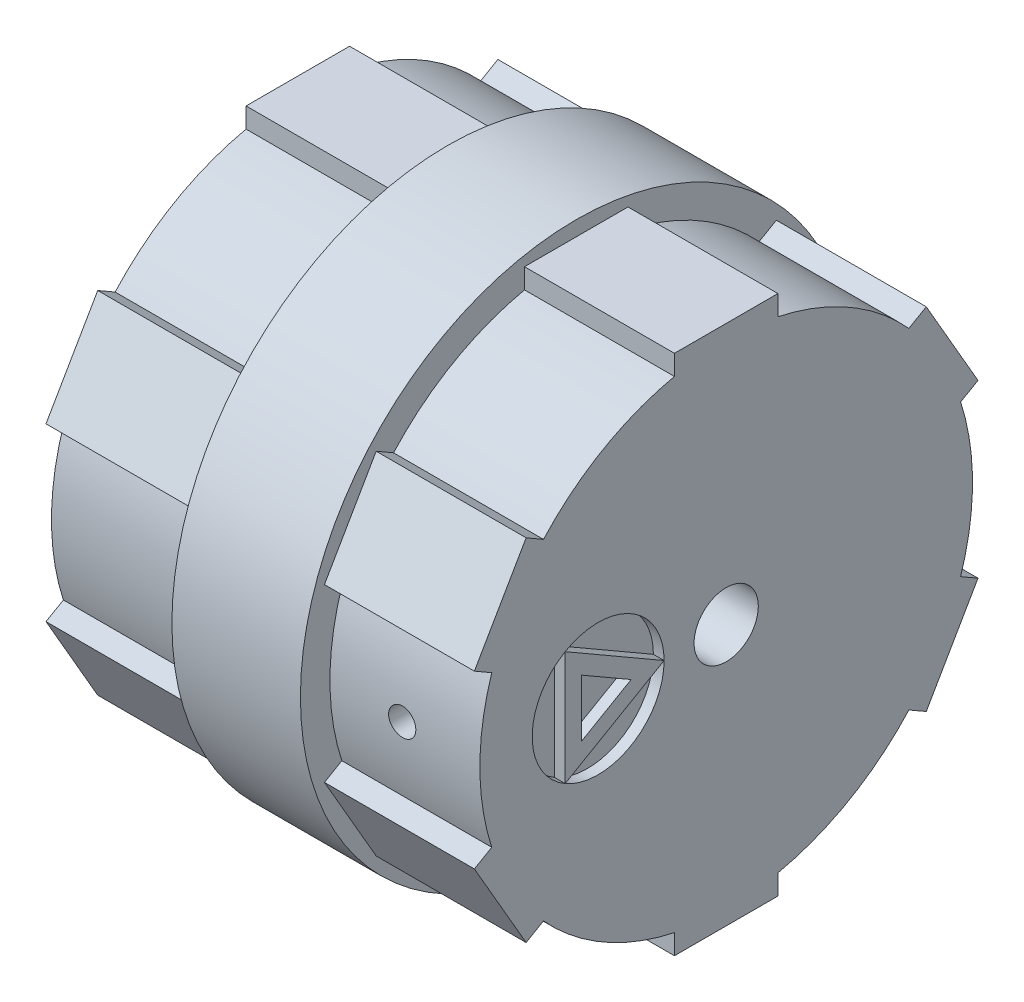
from build123d import *

# Parameters (mm, degrees)
CROQUIS1_R              = 11.5
SALIENTE_EXTRUIR1_DEPTH = 20
VACIADO2_T              = -3
CROQUIS2_R              = 1.5
CORTAR_EXTRUIR1_DEPTH   = 20
CROQUIS3_W              = 4.830825058
CROQUIS3_H              = 1.361160648
SALIENTE_EXTRUIR2_DEPTH = 20
CROQUIS4_W              = 6
CROQUIS4_H              = 1.635071494
CROQUIS5_R              = 4
CROQUIS5_R_2            = 1.5
SALIENTE_EXTRUIR3_DEPTH = 4
CROQUIS6_R              = 3.079540119
CORTAR_EXTRUIR3_DEPTH   = 0.5
SALIENTE_EXTRUIR4_DEPTH = 0.5
CROQUIS9_R              = 0.635
CORTAR_EXTRUIR4_DEPTH   = 20


with BuildPart() as part:
    # Croquis1 → Saliente-Extruir1 (new body)
    with BuildSketch(Plane(origin=(0, 0, 0), x_dir=(0, 0, -1), z_dir=(1, 0, 0))):
        Circle(CROQUIS1_R)
    extrude(amount=SALIENTE_EXTRUIR1_DEPTH)

    # Vaciado2
    vaciado2_openings = [part.faces().sort_by_distance(p)[0] for p in [
        (0, 0, 0),
    ]]
    offset(amount=VACIADO2_T, openings=vaciado2_openings, kind=Kind.INTERSECTION)

    # Croquis2 → Cortar-Extruir1 (cut)
    with BuildSketch(Plane(origin=(20, 0, 0), x_dir=(0, 0, -1), z_dir=(1, 0, 0))):
        Circle(CROQUIS2_R)
    extrude(amount=-CORTAR_EXTRUIR1_DEPTH, mode=Mode.SUBTRACT)

    # Croquis3 → Saliente-Extruir2 (add, through all)
    with BuildSketch(Plane(origin=(20, 0, 0), x_dir=(0, 0, -1), z_dir=(1, 0, 0))):
        with Locations((0, 11.5)):
            Rectangle(CROQUIS3_W, CROQUIS3_H)
        Polygon((8.162186029, 7.501518448), (9.340985729, 8.182098773), (11.756398258, 3.998481552), (10.577598558, 3.317901227), align=None)
        Polygon((10.577598558, -3.317901227), (11.756398258, -3.998481552), (9.340985729, -8.182098773), (8.162186029, -7.501518448), align=None)
        with Locations((0, -11.5)):
            Rectangle(CROQUIS3_W, CROQUIS3_H)
        Polygon((-8.162186029, -7.501518448), (-9.340985729, -8.182098773), (-11.756398258, -3.998481552), (-10.577598558, -3.317901227), align=None)
        Polygon((-10.577598558, 3.317901227), (-11.756398258, 3.998481552), (-9.340985729, 8.182098773), (-8.162186029, 7.501518448), align=None)
    extrude(amount=-SALIENTE_EXTRUIR2_DEPTH)

    # Croquis4 → Revolución1 (revolve)
    with BuildSketch(Plane.XY, mode=Mode.PRIVATE) as revoluci_n1_sk:
        with Locations((10, 12.06101307)):
            Rectangle(CROQUIS4_W, CROQUIS4_H)
    revolve(revoluci_n1_sk.sketch.rotate(Axis((-1.379569835, 0, 0), (1, 0, 0)), 90), axis=Axis((-1.379569835, 0, 0), (1, 0, 0)))

    # Croquis5 → Saliente-Extruir3 (add)
    with BuildSketch(Plane.ZY.offset(-17)):
        with Locations(Location((0, 0, 0), (0, 0, 180))):
            Circle(CROQUIS5_R)
        with Locations(Location((0, 0, 0), (0, 0, 180))):
            Circle(CROQUIS5_R_2, mode=Mode.SUBTRACT)
    extrude(amount=SALIENTE_EXTRUIR3_DEPTH)

    # Croquis6 → Cortar-Extruir3 (cut)
    with BuildSketch(Plane(origin=(20, 0, 0), x_dir=(0, 0, -1), z_dir=(1, 0, 0))):
        with Locations((-5.977795462, 0)):
            Circle(CROQUIS6_R)
    extrude(amount=-CORTAR_EXTRUIR3_DEPTH, mode=Mode.SUBTRACT)

    # Croquis9 → Cortar-Extruir4 (cut)
    with BuildSketch(Plane.XY):
        with Locations(Location((16.373914727, 0, 0), (0, 0, 180))):
            Circle(CROQUIS9_R)
    extrude(amount=CORTAR_EXTRUIR4_DEPTH, mode=Mode.SUBTRACT)


with BuildPart() as body_2:
    # Croquis8 → Saliente-Extruir4 (new body)
    with BuildSketch(Plane(origin=(20, 0, 0), x_dir=(0, 0, -1), z_dir=(1, 0, 0))):
        Polygon((-2.898255343, 0), (-7.517565521, 2.666959975), (-7.517565521, -2.666959975), align=None)
        Polygon((-4.438025402, 0), (-6.747680491, 1.333479987), (-6.747680491, -1.333479987), align=None, mode=Mode.SUBTRACT)
    extrude(amount=-SALIENTE_EXTRUIR4_DEPTH)


solid = Compound([part.part, body_2.part])
